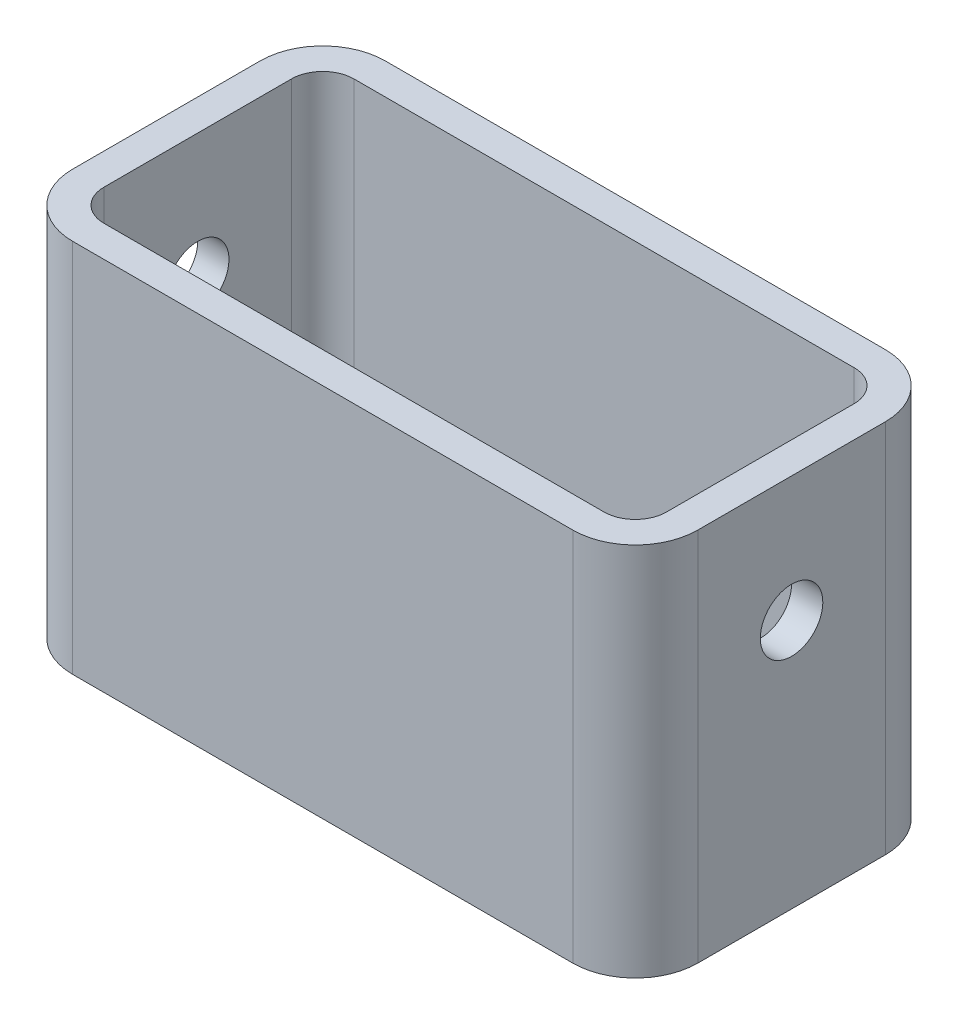
from build123d import *

# Parameters (mm, degrees)
SKETCH1_W           = 100
SKETCH1_H           = 60
BOSS_EXTRUDE1_DEPTH = 50
FILLET1_R           = 10
FILLET2_R           = 10
SHELL1_T            = -5
SKETCH2_R           = 5
CUT_EXTRUDE1_DEPTH  = 117.577473479


with BuildPart() as part:
    # Sketch1 → Boss-Extrude1 (new body)
    with BuildSketch(Plane.XY):
        with Locations((3.465346535, -3.01980198)):
            Rectangle(SKETCH1_W, SKETCH1_H)
    extrude(amount=BOSS_EXTRUDE1_DEPTH)

    # Fillet1
    fillet1_edges = [part.edges().sort_by_distance(p)[0] for p in [
        (53.465346535, -3.01980198, 50),
    ]]
    fillet(fillet1_edges, radius=FILLET1_R)

    # Fillet2
    fillet2_edges = [part.edges().sort_by_distance(p)[0] for p in [
        (-46.534653465, -3.01980198, 50),
        (53.465346535, -3.01980198, 0),
        (-46.534653465, -3.01980198, 0),
    ]]
    fillet(fillet2_edges, radius=FILLET2_R)

    # Shell1
    shell1_openings = [part.faces().sort_by_distance(p)[0] for p in [
        (3.465346535, 26.98019802, 25),
    ]]
    offset(amount=SHELL1_T, openings=shell1_openings, kind=Kind.INTERSECTION)

    # Sketch2 → Cut-Extrude1 (cut, through all)
    with BuildSketch(Plane(origin=(53.465346535, 0, 0), x_dir=(0, 0, -1), z_dir=(1, 0, 0))):
        with Locations(Location((-25, 6.98019802, 0), (0, 0, 90))):
            Circle(SKETCH2_R)
    extrude(amount=-CUT_EXTRUDE1_DEPTH, mode=Mode.SUBTRACT)


solid = part.part
